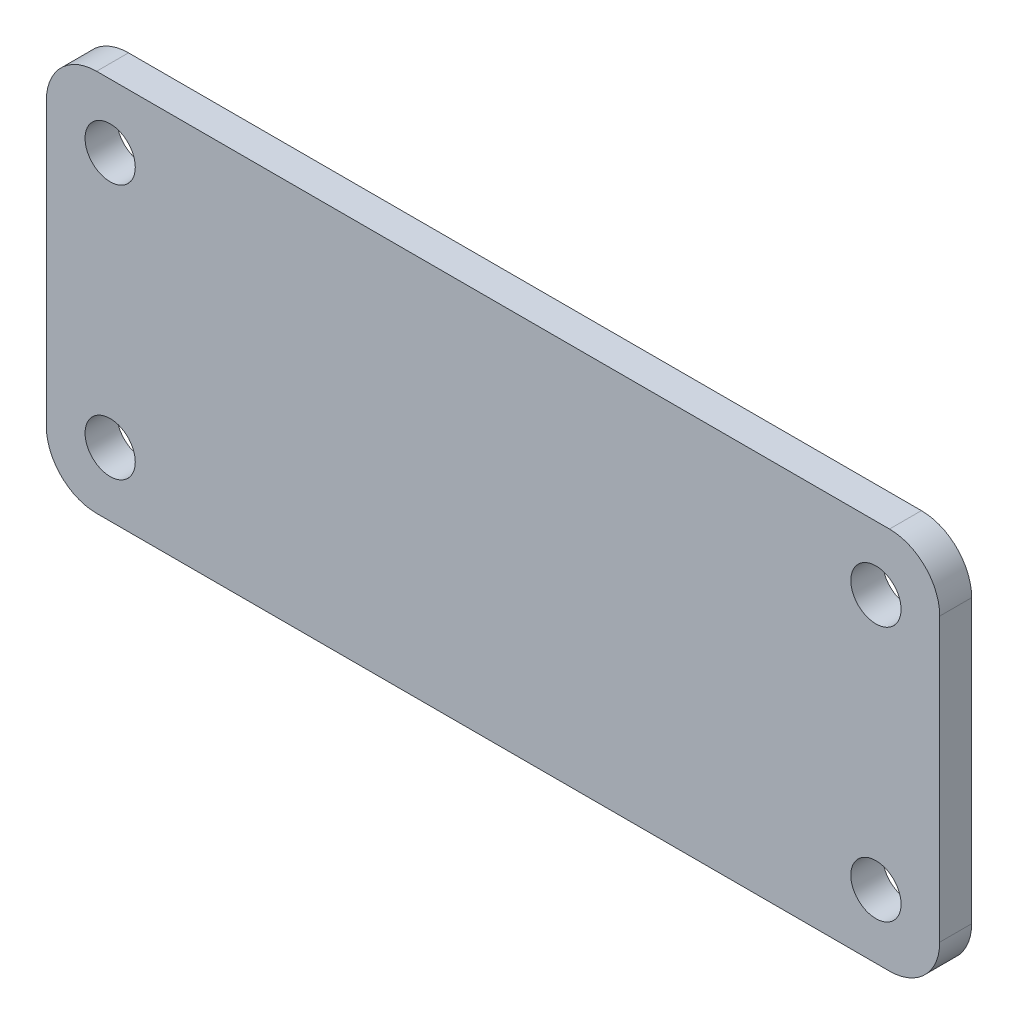
from build123d import *

# Parameters (mm, degrees)
SKETCH1_R           = 2.5
BOSS_EXTRUDE1_DEPTH = 3.175


with BuildPart() as part:
    # Sketch1 → Boss-Extrude1 (new body)
    with BuildSketch(Plane.XY):
        with BuildLine():
            Line((5, 0), (83.9, 0))
            ThreePointArc((83.9, 0), (87.435533906, 1.464466094), (88.9, 5))
            Line((88.9, 5), (88.9, 33.1))
            ThreePointArc((88.9, 33.1), (87.435533906, 36.635533906), (83.9, 38.1))
            Line((83.9, 38.1), (5, 38.1))
            ThreePointArc((5, 38.1), (1.464466094, 36.635533906), (0, 33.1))
            Line((0, 33.1), (0, 5))
            ThreePointArc((0, 5), (1.464466094, 1.464466094), (5, 0))
        make_face()
        with Locations((6.35, 31.75)):
            Circle(SKETCH1_R, mode=Mode.SUBTRACT)
        with Locations((82.55, 31.75)):
            Circle(SKETCH1_R, mode=Mode.SUBTRACT)
        with Locations((82.55, 6.35)):
            Circle(SKETCH1_R, mode=Mode.SUBTRACT)
        with Locations((6.35, 6.35)):
            Circle(SKETCH1_R, mode=Mode.SUBTRACT)
    extrude(amount=BOSS_EXTRUDE1_DEPTH)


solid = part.part
